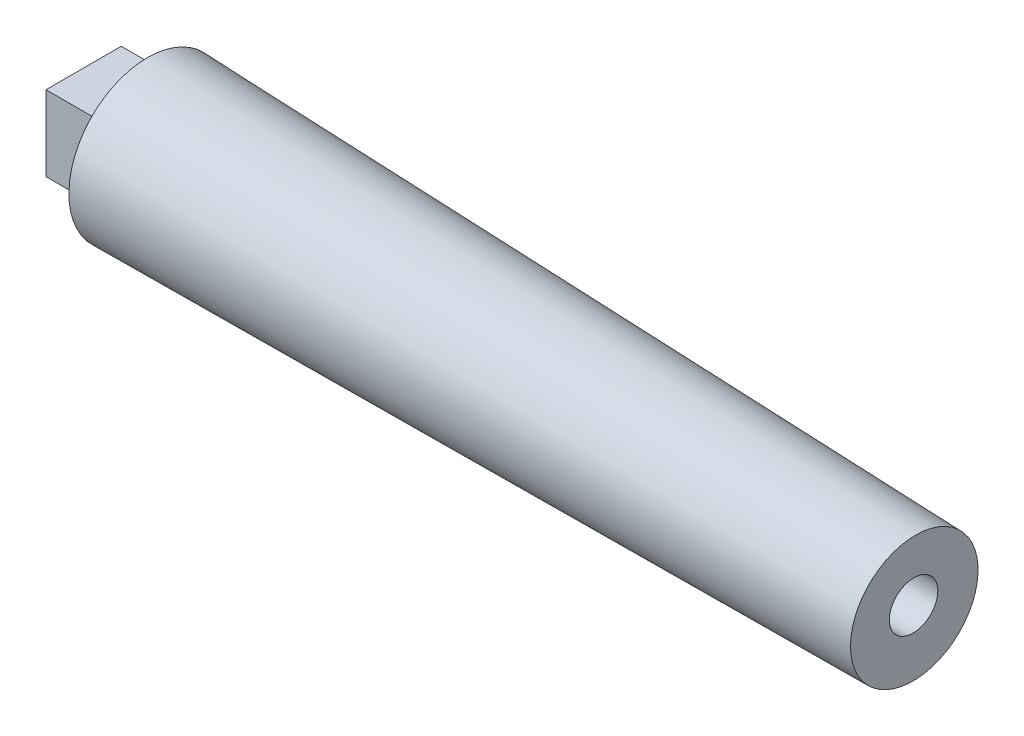
from build123d import *

# Parameters (mm, degrees)
SKETCH4_R           = 4.826
CUT_EXTRUDE1_DEPTH  = 12.7
SKETCH6_R           = 15.875
CUT_EXTRUDE2_DEPTH  = 12.7
SKETCH8_W           = 14.986
SKETCH8_H           = 14.986
BOSS_EXTRUDE1_DEPTH = 12.7


with BuildPart() as part:
    # Sketch3 → Revolve5 (revolve)
    with BuildSketch(Plane.XY, mode=Mode.PRIVATE) as revolve5_sk:
        Polygon((0, 0), (165.1, 0), (165.1, 12.7), (0, 15.875), align=None)
    revolve(revolve5_sk.sketch.rotate(Axis((165.1, 12.7, 0), (-0.9998151400298467, 0.01922721423134321, 0)), 180), axis=Axis((165.1, 12.7, 0), (-0.9998151400298467, 0.01922721423134321, 0)))

    # Sketch4 → Cut-Extrude1 (cut, symmetric)
    with BuildSketch(Plane(origin=(165.1, 0, 0), x_dir=(0, 0, -1), z_dir=(1, 0, 0))):
        with Locations((0, 13.089439927)):
            Circle(SKETCH4_R)
    extrude(amount=CUT_EXTRUDE1_DEPTH, both=True, mode=Mode.SUBTRACT)

    # Sketch6 → Cut-Extrude2 (cut)
    with BuildSketch(Plane(origin=(0, 0, 0), x_dir=(0, 0, -1), z_dir=(1, 0, 0))):
        with Locations((0, 15.875)):
            Circle(SKETCH6_R)
    extrude(amount=CUT_EXTRUDE2_DEPTH, mode=Mode.SUBTRACT)

    # Sketch8 → Boss-Extrude1 (add)
    with BuildSketch(Plane.ZY.offset(-12.7)):
        with Locations((0, 15.636551979)):
            Rectangle(SKETCH8_W, SKETCH8_H)
    extrude(amount=BOSS_EXTRUDE1_DEPTH)


solid = part.part
